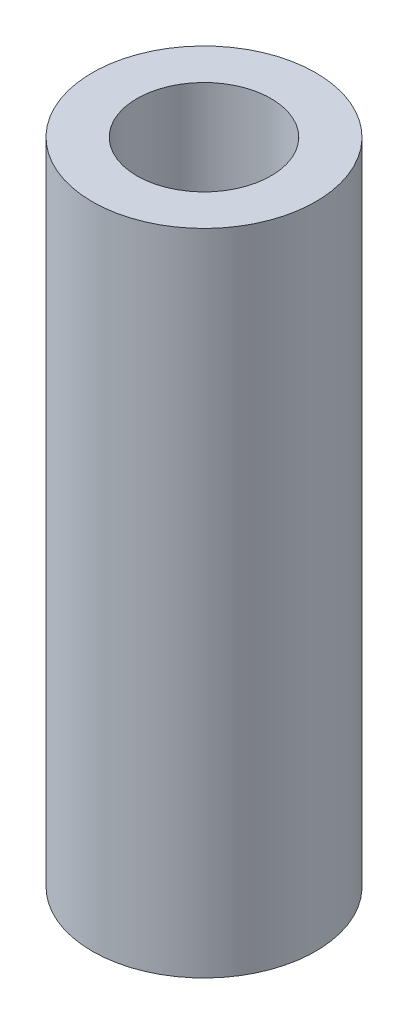
from build123d import *

# Parameters (mm, degrees)
SKETCH1_R           = 5.25
BOSS_EXTRUDE1_DEPTH = 30.5
SKETCH2_R           = 3.15
CUT_EXTRUDE1_DEPTH  = 32.390683331


with BuildPart() as part:
    # Sketch1 → Boss-Extrude1 (new body)
    with BuildSketch(Plane(origin=(0, 0, 0), x_dir=(1, 0, 0), z_dir=(0, 1, 0))):
        with Locations(Location((0, 0, 0), (0, 0, 90))):
            Circle(SKETCH1_R)
    extrude(amount=BOSS_EXTRUDE1_DEPTH)

    # Sketch2 → Cut-Extrude1 (cut, through all)
    with BuildSketch(Plane(origin=(0, 30.5, 0), x_dir=(1, 0, 0), z_dir=(0, 1, 0))):
        with Locations(Location((0, 0, 0), (0, 0, 270))):
            Circle(SKETCH2_R)
    extrude(amount=-CUT_EXTRUDE1_DEPTH, mode=Mode.SUBTRACT)


solid = part.part
